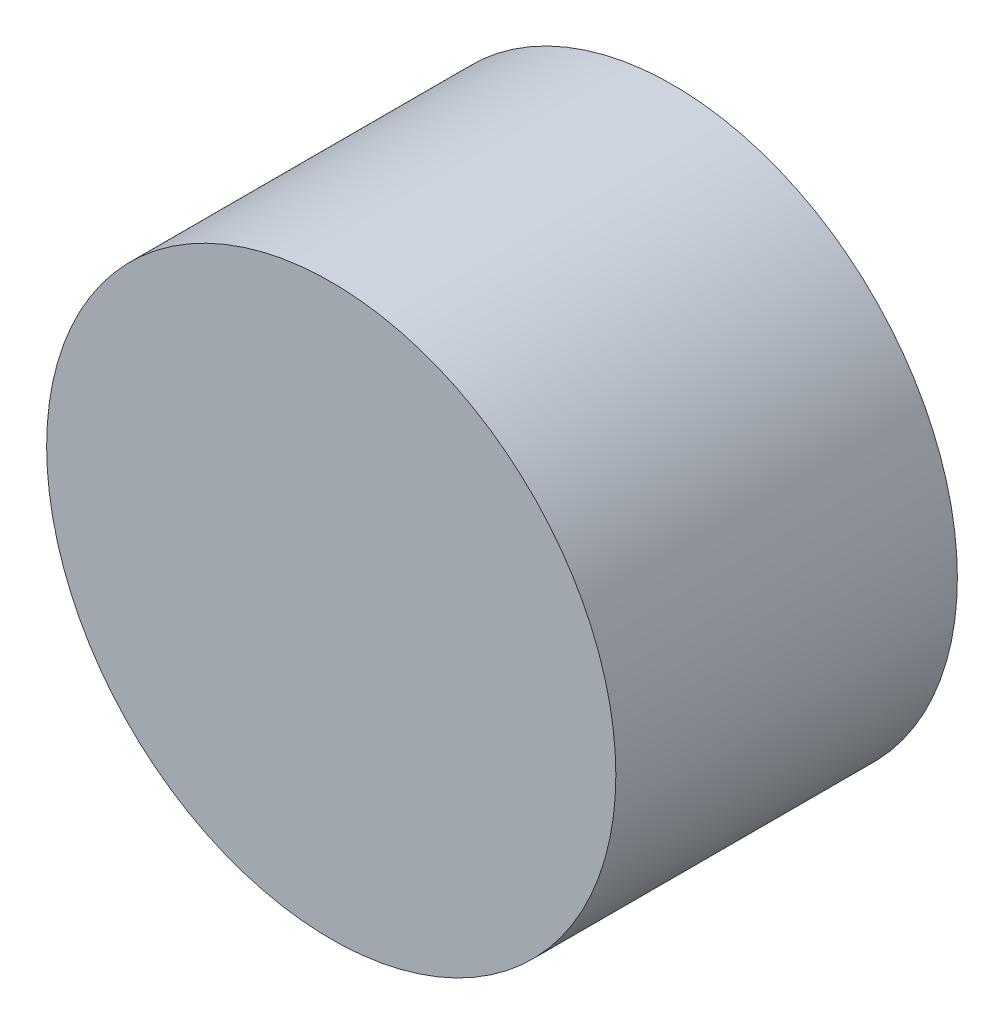
from build123d import *

# Parameters (mm, degrees)
SKETCH1_R           = 50
BOSS_EXTRUDE1_DEPTH = 60


with BuildPart() as part:
    # Sketch1 → Boss-Extrude1 (new body)
    with BuildSketch(Plane.XY):
        Circle(SKETCH1_R)
    extrude(amount=BOSS_EXTRUDE1_DEPTH)


solid = part.part
